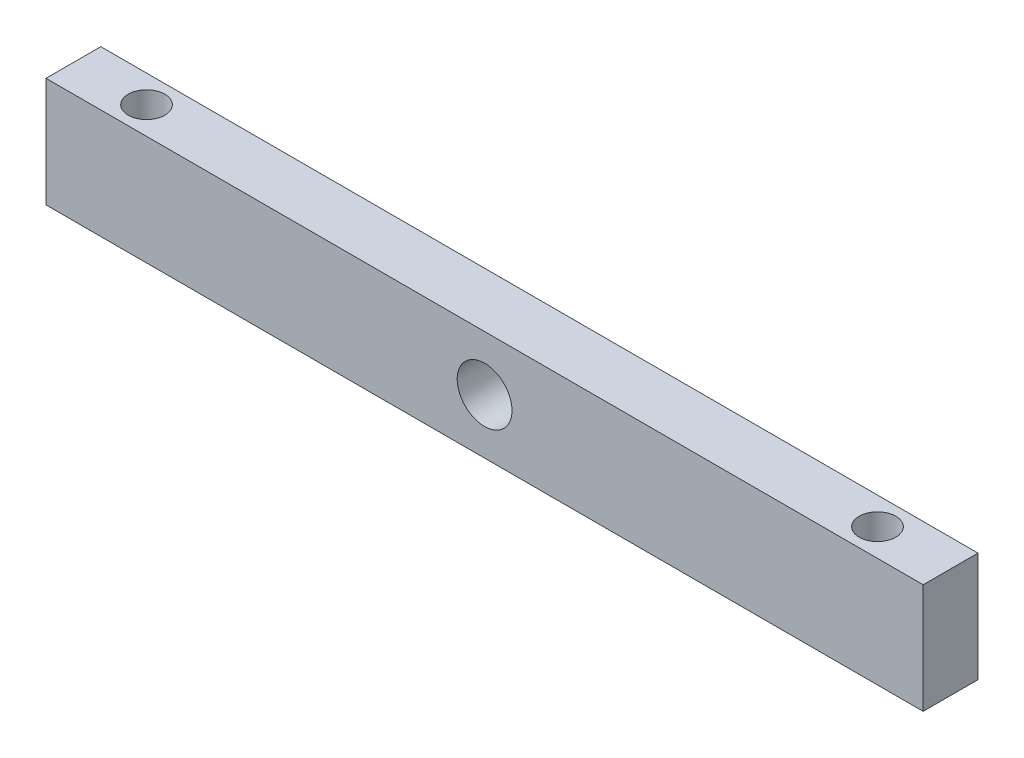
from build123d import *

# Parameters (mm, degrees)
RESSALTO_EXTRUS_O1_DEPTH = 15
CORTE_EXTRUS_O1_DEPTH    = 15
ESBO_O10_R               = 5
CORTE_EXTRUS_O9_DEPTH    = 79


with BuildPart() as part:
    # Esboço1 → Ressalto-extrusão1 (new body)
    with BuildSketch(Plane.XY):
        Polygon((100, 0), (-100, 0), (-120, 0), (-120, 30), (-100, 30), (100, 30), (120, 30), (120, 0), align=None)
    extrude(amount=RESSALTO_EXTRUS_O1_DEPTH)

    # Esboço2 → Corte-extrusão1 (cut)
    with BuildSketch(Plane.XY.offset(15)):
        with BuildLine():
            ThreePointArc((7.5, 15), (5.303300859, 20.303300859), (0, 22.5))
            Line((0, 22.5), (0, 7.5))
            ThreePointArc((0, 7.5), (5.303300859, 9.696699141), (7.5, 15))
        make_face()
        with BuildLine():
            Line((0, 7.5), (0, 22.5))
            ThreePointArc((0, 22.5), (-7.5, 15), (0, 7.5))
        make_face()
    extrude(amount=-CORTE_EXTRUS_O1_DEPTH, mode=Mode.SUBTRACT)

    # Esboço10 → Corte-extrusão9 (cut)
    with BuildSketch(Plane(origin=(0, 0, 0), x_dir=(-1, 0, 0), z_dir=(0, -1, 0))):
        with Locations(Location((100, -7.5, 0), (0, 0, 90))):
            Circle(ESBO_O10_R)
        with Locations(Location((-100, -7.5, 0), (0, 0, 90))):
            Circle(ESBO_O10_R)
    extrude(amount=-CORTE_EXTRUS_O9_DEPTH, mode=Mode.SUBTRACT)


solid = part.part
